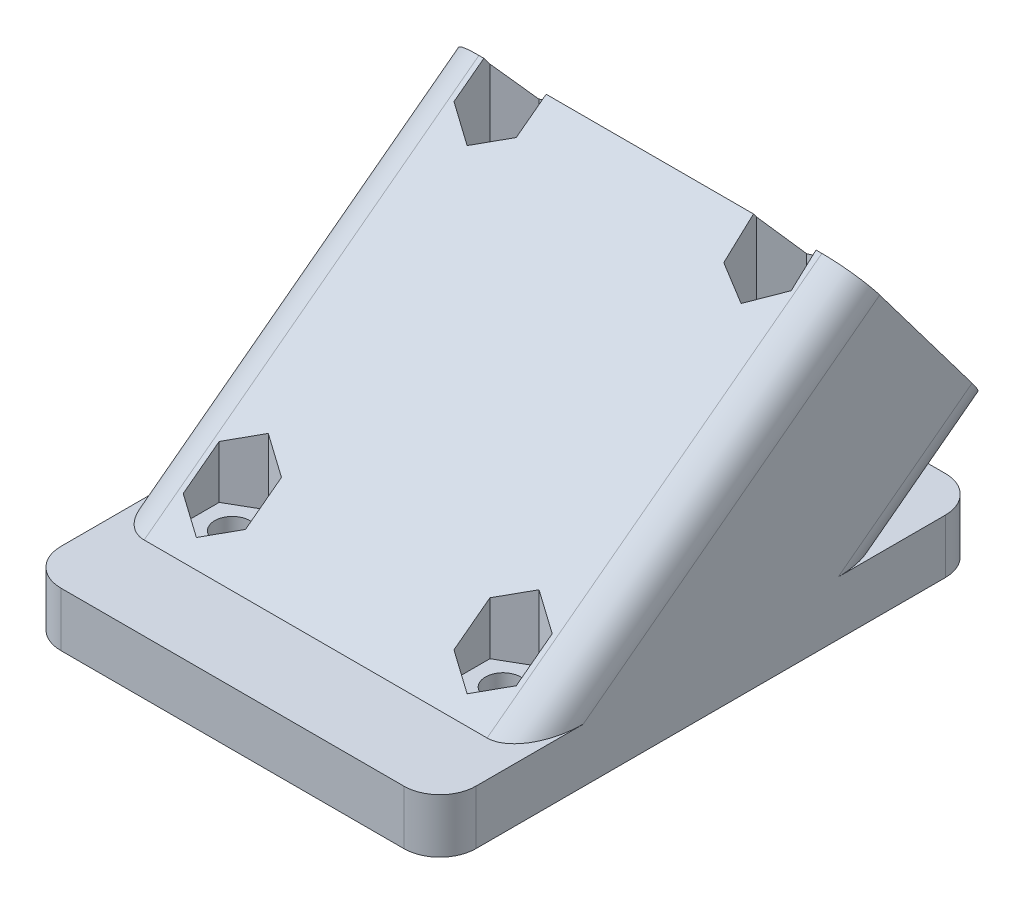
from build123d import *

# Parameters (mm, degrees)
BOSS_EXTRUDE1_DEPTH = 23
CUT_EXTRUDE1_REACH  = 53.631
SKETCH4_R           = 1.95
CUT_EXTRUDE3_REACH  = 59.631
CUT_EXTRUDE3_START  = -6
CUT_EXTRUDE4_REACH  = 65.269
SKETCH7_R           = 2.75
CUT_EXTRUDE5_REACH  = 85.269
CUT_EXTRUDE5_START  = -20
SKETCH8_R           = 5
FILLET1_R           = 4


with BuildPart() as part:
    # Sketch3 → Boss-Extrude1 (new, symmetric)
    with BuildSketch(Plane(origin=(0, 0, 0), x_dir=(0, 0, -1), z_dir=(1, 0, 0))):
        Polygon((31.368752944, 7.9863551), (20.770501764, 0), (30, 0), (30, -6), (-30, -6), (-30, 0), (-20.770501764, 0), (16.323377365, 27.952242852), align=None)
    extrude(amount=BOSS_EXTRUDE1_DEPTH, both=True)

    # Sketch4 → Cut-Extrude1 (cut, up to next)
    with BuildSketch(Plane(origin=(0, -6, 0), x_dir=(-1, 0, 0), z_dir=(0, -1, 0)), mode=Mode.PRIVATE) as cut_extrude1_sk1:
        with Locations(Location((15, 15, 0), (0, 0, 90))):
            Circle(SKETCH4_R)
    cut_extrude1_tool1 = extrude(cut_extrude1_sk1.sketch, amount=-CUT_EXTRUDE1_REACH, mode=Mode.PRIVATE) & part.part
    # Sketch4 → Cut-Extrude1 (cut, up to next)
    with BuildSketch(Plane(origin=(0, -6, 0), x_dir=(-1, 0, 0), z_dir=(0, -1, 0)), mode=Mode.PRIVATE) as cut_extrude1_sk2:
        with Locations(Location((15, -15, 0), (0, 0, 90))):
            Circle(SKETCH4_R)
    cut_extrude1_tool2 = extrude(cut_extrude1_sk2.sketch, amount=-CUT_EXTRUDE1_REACH, mode=Mode.PRIVATE) & part.part
    # Sketch4 → Cut-Extrude1 (cut, up to next)
    with BuildSketch(Plane(origin=(0, -6, 0), x_dir=(-1, 0, 0), z_dir=(0, -1, 0)), mode=Mode.PRIVATE) as cut_extrude1_sk3:
        with Locations(Location((-15, -15, 0), (0, 0, 90))):
            Circle(SKETCH4_R)
    cut_extrude1_tool3 = extrude(cut_extrude1_sk3.sketch, amount=-CUT_EXTRUDE1_REACH, mode=Mode.PRIVATE) & part.part
    # Sketch4 → Cut-Extrude1 (cut, up to next)
    with BuildSketch(Plane(origin=(0, -6, 0), x_dir=(-1, 0, 0), z_dir=(0, -1, 0)), mode=Mode.PRIVATE) as cut_extrude1_sk4:
        with Locations(Location((-15, 15, 0), (0, 0, 90))):
            Circle(SKETCH4_R)
    cut_extrude1_tool4 = extrude(cut_extrude1_sk4.sketch, amount=-CUT_EXTRUDE1_REACH, mode=Mode.PRIVATE) & part.part
    add(cut_extrude1_tool1.solids().sort_by_distance((-15, -6, -15))[0], mode=Mode.SUBTRACT)
    add(cut_extrude1_tool2.solids().sort_by_distance((-15, -6, 15))[0], mode=Mode.SUBTRACT)
    add(cut_extrude1_tool3.solids().sort_by_distance((15, -6, 15))[0], mode=Mode.SUBTRACT)
    add(cut_extrude1_tool4.solids().sort_by_distance((15, -6, -15))[0], mode=Mode.SUBTRACT)

    # Sketch6 → Cut-Extrude3 (cut, up to next)
    with BuildSketch(Plane(origin=(0, -6, 0), x_dir=(-1, 0, 0), z_dir=(0, -1, 0)).offset(CUT_EXTRUDE3_START), mode=Mode.PRIVATE) as cut_extrude3_sk1:
        Polygon((-15, -18.983716857), (-18.45, -16.991858429), (-18.45, -13.008141571), (-15, -11.016283143), (-11.55, -13.008141571), (-11.55, -16.991858429), align=None)
    cut_extrude3_tool1 = extrude(cut_extrude3_sk1.sketch, amount=-CUT_EXTRUDE3_REACH, mode=Mode.PRIVATE) & part.part
    # Sketch6 → Cut-Extrude3 (cut, up to next)
    with BuildSketch(Plane(origin=(0, -6, 0), x_dir=(-1, 0, 0), z_dir=(0, -1, 0)).offset(CUT_EXTRUDE3_START), mode=Mode.PRIVATE) as cut_extrude3_sk2:
        Polygon((18.45, -16.991858429), (18.45, -13.008141571), (15, -11.016283143), (11.55, -13.008141571), (11.55, -16.991858429), (15, -18.983716857), align=None)
    cut_extrude3_tool2 = extrude(cut_extrude3_sk2.sketch, amount=-CUT_EXTRUDE3_REACH, mode=Mode.PRIVATE) & part.part
    # Sketch6 → Cut-Extrude3 (cut, up to next)
    with BuildSketch(Plane(origin=(0, -6, 0), x_dir=(-1, 0, 0), z_dir=(0, -1, 0)).offset(CUT_EXTRUDE3_START), mode=Mode.PRIVATE) as cut_extrude3_sk3:
        Polygon((15, 11.016283143), (18.45, 13.008141571), (18.45, 16.991858429), (15, 18.983716857), (11.55, 16.991858429), (11.55, 13.008141571), align=None)
    cut_extrude3_tool3 = extrude(cut_extrude3_sk3.sketch, amount=-CUT_EXTRUDE3_REACH, mode=Mode.PRIVATE) & part.part
    # Sketch6 → Cut-Extrude3 (cut, up to next)
    with BuildSketch(Plane(origin=(0, -6, 0), x_dir=(-1, 0, 0), z_dir=(0, -1, 0)).offset(CUT_EXTRUDE3_START), mode=Mode.PRIVATE) as cut_extrude3_sk4:
        Polygon((-11.733099869, 12.720227307), (-11.392208867, 16.689332159), (-14.659108999, 18.969104852), (-18.266900131, 17.279772693), (-18.607791133, 13.310667841), (-15.340891001, 11.030895148), align=None)
    cut_extrude3_tool4 = extrude(cut_extrude3_sk4.sketch, amount=-CUT_EXTRUDE3_REACH, mode=Mode.PRIVATE) & part.part
    add(cut_extrude3_tool1.solids().sort_by_distance((15, 0, 15))[0], mode=Mode.SUBTRACT)
    add(cut_extrude3_tool2.solids().sort_by_distance((-15, 0, 15))[0], mode=Mode.SUBTRACT)
    add(cut_extrude3_tool3.solids().sort_by_distance((-15, 0, -15))[0], mode=Mode.SUBTRACT)
    add(cut_extrude3_tool4.solids().sort_by_distance((15, 0, -15))[0], mode=Mode.SUBTRACT)

    # Cut-Extrude4: up to this plane
    cut_extrude4_end = Plane(origin=(23, -6, -30), z_dir=(0, 1, 0))
    # Sketch7 → Cut-Extrude4 (cut, up to the surface)
    with BuildSketch(Plane(origin=(0, 17.969298976, -23.846065154), x_dir=(-1, 0, 0), z_dir=(0, 0.6018150231520492, -0.7986355100472922)), mode=Mode.PRIVATE) as cut_extrude4_sk1:
        with Locations(Location((0, 0, 0), (0, 0, 90))):
            Circle(SKETCH7_R)
    cut_extrude4_tool1 = split(extrude(cut_extrude4_sk1.sketch, amount=-CUT_EXTRUDE4_REACH, mode=Mode.PRIVATE), bisect_by=cut_extrude4_end, keep=Keep.BOTH, mode=Mode.PRIVATE)
    add(cut_extrude4_tool1.solids().sort_by_distance((0, 17.969299, -23.846065))[0], mode=Mode.SUBTRACT)

    # Cut-Extrude5: up to this plane
    cut_extrude5_end = Plane(origin=(23, -6, -30), z_dir=(0, 1, 0))
    # Sketch8 → Cut-Extrude5 (cut, up to the surface)
    with BuildSketch(Plane(origin=(0, 17.969298976, -23.846065154), x_dir=(-1, 0, 0), z_dir=(0, 0.6018150231520492, -0.7986355100472922)).offset(CUT_EXTRUDE5_START), mode=Mode.PRIVATE) as cut_extrude5_sk1:
        with Locations(Location((0, 0, 0), (0, 0, 90))):
            Circle(SKETCH8_R)
    cut_extrude5_tool1 = split(extrude(cut_extrude5_sk1.sketch, amount=-CUT_EXTRUDE5_REACH, mode=Mode.PRIVATE), bisect_by=cut_extrude5_end, keep=Keep.BOTH, mode=Mode.PRIVATE)
    add(cut_extrude5_tool1.solids().sort_by_distance((0, 5.932999, -7.873355))[0], mode=Mode.SUBTRACT)

    # Fillet1
    fillet1_edges = [part.edges().sort_by_distance(p)[0] for p in [
        (-23, 13.976121426, 2.2235622),
        (23, -3, 30),
        (23, -3, -30),
        (23, 3.99317755, -26.069627354),
        (23, 13.976121426, 2.2235622),
        (-23, 3.99317755, -26.069627354),
        (-23, -3, -30),
        (-23, -3, 30),
    ]]
    fillet(fillet1_edges, radius=FILLET1_R)


solid = part.part
